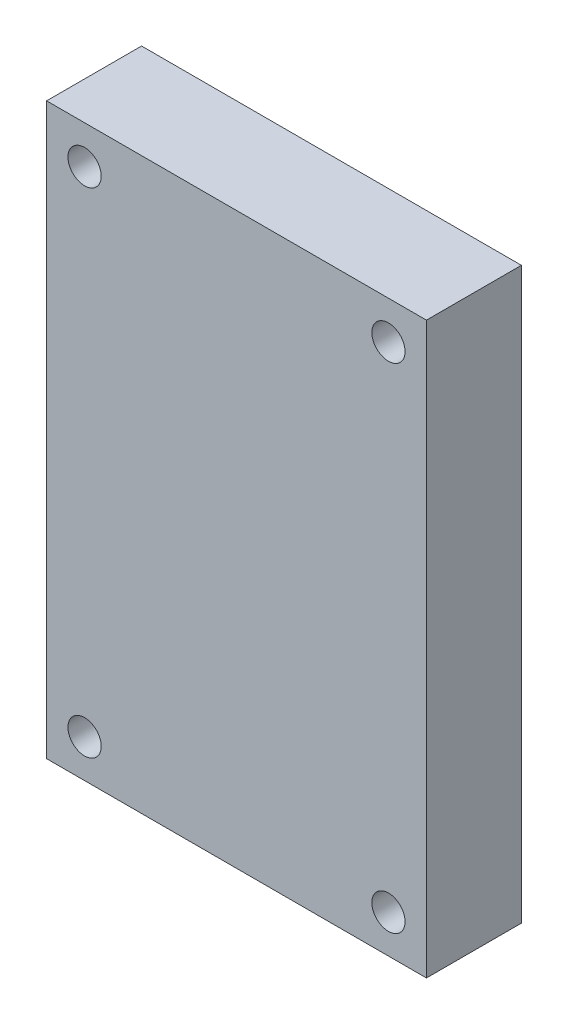
from build123d import *

# Parameters (mm, degrees)
SKETCH1_W           = 40
SKETCH1_H           = 60
SKETCH1_R           = 1.75
BOSS_EXTRUDE1_DEPTH = 10
SKETCH3_R           = 3
CUT_EXTRUDE1_DEPTH  = 5


with BuildPart() as part:
    # Sketch1 → Boss-Extrude1 (new body)
    with BuildSketch(Plane.XY):
        Rectangle(SKETCH1_W, SKETCH1_H)
        with Locations((-16, 26)):
            Circle(SKETCH1_R, mode=Mode.SUBTRACT)
        with Locations((16, 26)):
            Circle(SKETCH1_R, mode=Mode.SUBTRACT)
        with Locations((16, -26)):
            Circle(SKETCH1_R, mode=Mode.SUBTRACT)
        with Locations((-16, -26)):
            Circle(SKETCH1_R, mode=Mode.SUBTRACT)
    extrude(amount=BOSS_EXTRUDE1_DEPTH)

    # Sketch3 → Cut-Extrude1 (cut)
    with BuildSketch(Plane.XY):
        with Locations((16, 26)):
            Circle(SKETCH3_R)
        with Locations((-16, 26)):
            Circle(SKETCH3_R)
        with Locations((16, -26)):
            Circle(SKETCH3_R)
        with Locations((-16, -26)):
            Circle(SKETCH3_R)
    extrude(amount=CUT_EXTRUDE1_DEPTH, mode=Mode.SUBTRACT)


solid = part.part
